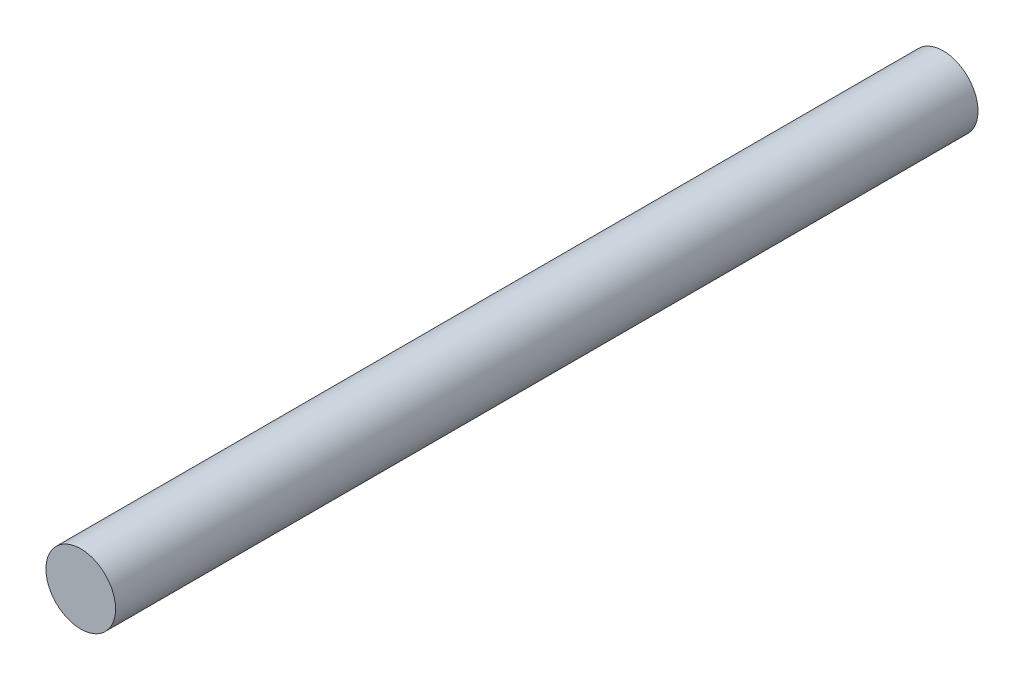
from build123d import *

# Parameters (mm, degrees)
CROQUIS1_R              = 2.95
SALIENTE_EXTRUIR1_DEPTH = 73.1


with BuildPart() as part:
    # Croquis1 → Saliente-Extruir1 (new body)
    with BuildSketch(Plane.XY):
        Circle(CROQUIS1_R)
    extrude(amount=SALIENTE_EXTRUIR1_DEPTH)


solid = part.part
